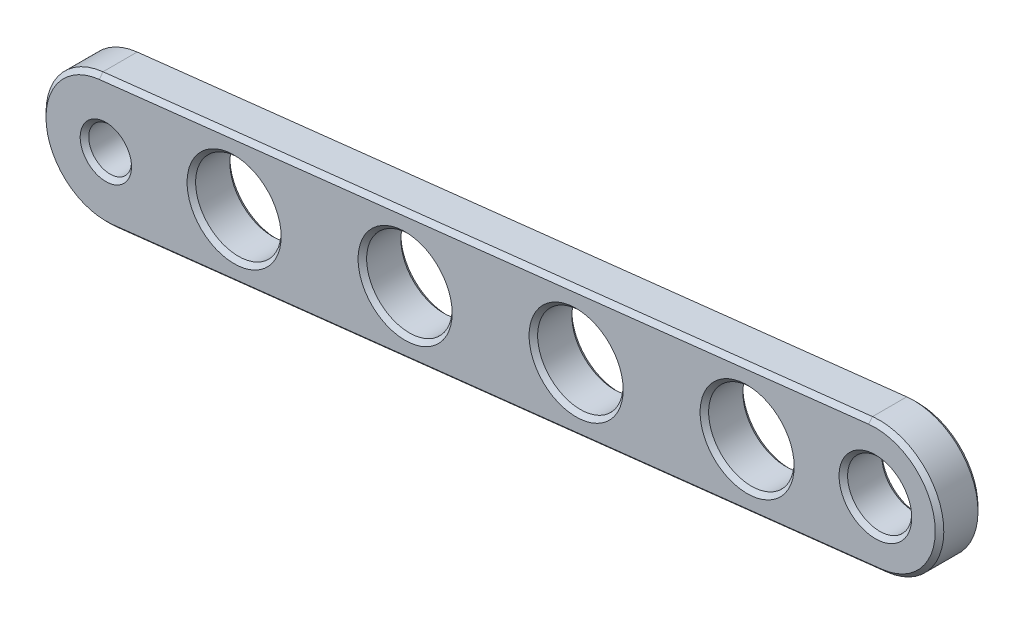
from build123d import *

# Parameters (mm, degrees)
SKETCH1_R           = 1.5
SKETCH1_R_2         = 1
SKETCH1_R_3         = 2
BOSS_EXTRUDE2_DEPTH = 2
CHAMFER1_SIZE       = 0.2


with BuildPart() as part:
    # Sketch1 → Boss-Extrude2 (new body)
    with BuildSketch(Plane.XY):
        with BuildLine():
            Line((144.740890425, 2.981378874), (180.740890425, 7.01122962))
            ThreePointArc((180.740890425, 7.01122962), (184.056005739, 4.363587187), (181.408363307, 1.048471873))
            Line((181.408363307, 1.048471873), (145.408363307, -2.981378874))
            ThreePointArc((145.408363307, -2.981378874), (142.093247992, -0.333736441), (144.740890425, 2.981378874))
        make_face()
        with Locations((181.074626866, 4.029850746)):
            Circle(SKETCH1_R, mode=Mode.SUBTRACT)
        with Locations((145.074626866, 0)):
            Circle(SKETCH1_R_2, mode=Mode.SUBTRACT)
        with Locations((151.074626866, 0.671641791)):
            Circle(SKETCH1_R_3, mode=Mode.SUBTRACT)
        with Locations((175.074626866, 3.358208955)):
            Circle(SKETCH1_R_3, mode=Mode.SUBTRACT)
        with Locations((167.074626866, 2.462686567)):
            Circle(SKETCH1_R_3, mode=Mode.SUBTRACT)
        with Locations((159.074626866, 1.567164179)):
            Circle(SKETCH1_R_3, mode=Mode.SUBTRACT)
    extrude(amount=BOSS_EXTRUDE2_DEPTH)

    # Chamfer1
    chamfer1_edges = [part.edges().sort_by_distance(p)[0] for p in [
        (179.574626866, 4.029850746, 0),
        (179.574626866, 4.029850746, 2),
        (184.056005739, 4.363587187, 2),
        (144.074626866, 0, 0),
        (144.074626866, 0, 2),
        (162.740890425, 4.996304247, 2),
        (149.074626866, 0.671641791, 0),
        (149.074626866, 0.671641791, 2),
        (173.074626866, 3.358208955, 0),
        (173.074626866, 3.358208955, 2),
        (165.074626866, 2.462686567, 0),
        (165.074626866, 2.462686567, 2),
        (157.074626866, 1.567164179, 0),
        (157.074626866, 1.567164179, 2),
        (142.093247992, -0.333736441, 2),
        (162.740890425, 4.996304247, 0),
        (184.056005739, 4.363587187, 0),
        (163.408363307, -0.9664535, 0),
        (142.093247992, -0.333736441, 0),
        (163.408363307, -0.9664535, 2),
    ]]
    chamfer(chamfer1_edges, length=CHAMFER1_SIZE)


solid = part.part
